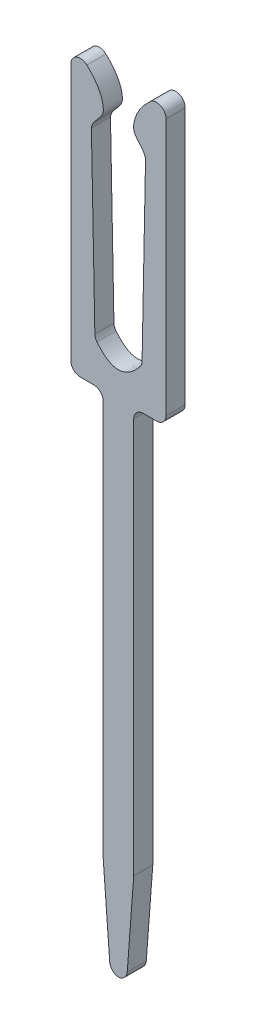
from build123d import *

# Parameters (mm, degrees)
BOSS_EXTRUDE1_DEPTH = 0.2


with BuildPart() as part:
    # Sketch1 → Boss-Extrude1 (new, symmetric)
    with BuildSketch(Plane.XY):
        with BuildLine():
            Line((-0.32, 1.999393664), (-0.32, 10.299393664))
            ThreePointArc((-0.32, 10.299393664), (-0.378578644, 10.44081502), (-0.52, 10.499393664))
            Line((-0.52, 10.499393664), (-0.8, 10.499393664))
            ThreePointArc((-0.8, 10.499393664), (-0.941421356, 10.557972308), (-1, 10.699393664))
            Line((-1, 10.699393664), (-1, 16.089817201))
            ThreePointArc((-1, 16.089817201), (-0.87939743, 16.273382034), (-0.663039519, 16.235562961))
            add(Edge.make_bspline(
                [(-0.663039519, 16.235562961), (-0.487599251, 16.070697902), (-0.326177604, 15.848773555), (-0.310671132, 15.420865905), (-0.548453888, 15.308603212), (-0.567669208, 15.140963485)],
                knots=[0.253308427, 0.253308427, 0.253308427, 0.253308427, 0.663171976, 0.707067436, 1, 1, 1, 1], degree=3))
            Line((-0.567669208, 15.140963485), (-0.495215905, 11.434303234))
            ThreePointArc((-0.495215905, 11.434303234), (-0.483221967, 11.369888483), (-0.451053839, 11.312806733))
            add(Edge.make_bspline(
                [(-0.451053839, 11.312806733), (0, 10.752430299), (0.451053839, 11.312806733)],
                knots=[0.043404734, 0.043404734, 0.043404734, 0.956595266, 0.956595266, 0.956595266], degree=2))
            ThreePointArc((0.451053839, 11.312806733), (0.483221967, 11.369888483), (0.495215905, 11.434303234))
            Line((0.495215905, 11.434303234), (0.567669208, 15.140963485))
            add(Edge.make_bspline(
                [(0.663039519, 16.235562961), (0.487599251, 16.070697902), (0.326177604, 15.848773555), (0.310671132, 15.420865905), (0.548453888, 15.308603212), (0.567669208, 15.140963485)],
                knots=[0.253308427, 0.253308427, 0.253308427, 0.253308427, 0.663171976, 0.707067436, 1, 1, 1, 1], degree=3))
            ThreePointArc((0.663039519, 16.235562961), (0.87939743, 16.273382034), (1, 16.089817201))
            Line((1, 16.089817201), (1, 10.699393664))
            ThreePointArc((1, 10.699393664), (0.941421356, 10.557972308), (0.8, 10.499393664))
            Line((0.8, 10.499393664), (0.52, 10.499393664))
            ThreePointArc((0.52, 10.499393664), (0.378578644, 10.44081502), (0.32, 10.299393664))
            Line((0.32, 10.299393664), (0.32, 1.999393664))
            Line((0.32, 1.999393664), (0.183878151, 0.184435674))
            ThreePointArc((0.183878151, 0.184435674), (0.126073555, 0.058186541), (0, 0))
            ThreePointArc((0, 0), (-0.126073555, 0.058186541), (-0.183878151, 0.184435674))
            Line((-0.183878151, 0.184435674), (-0.32, 1.999393664))
        make_face()
    extrude(amount=BOSS_EXTRUDE1_DEPTH, both=True)


solid = part.part
